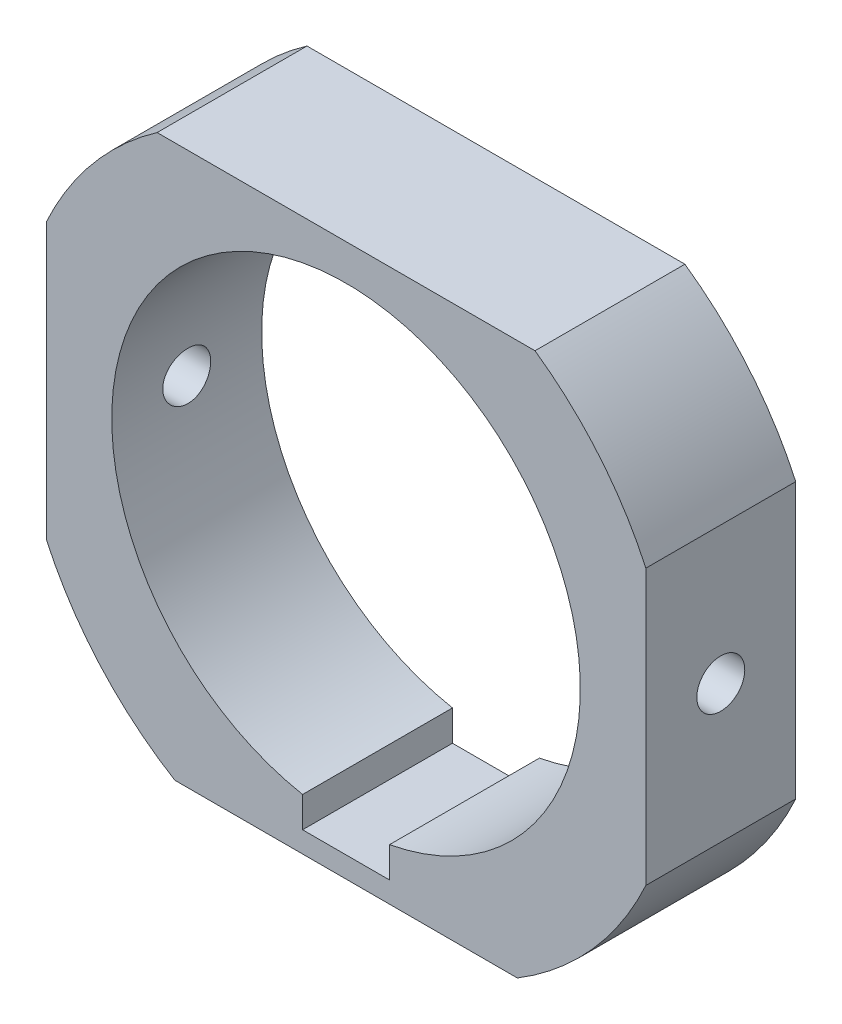
from build123d import *

# Parameters (mm, degrees)
BOSS_EXTRUDE1_DEPTH     = 5
CUT_EXTRUDE1_DEPTH      = 15.933519344
CUT_EXTRUDE1_DEPTH_BACK = 15.933519344
SKETCH2_W               = 5
SKETCH2_H               = 0.5
SKETCH3_R               = 0.8
CUT_EXTRUDE2_DEPTH      = 23.657449106


with BuildPart() as part:
    # Sketch1 → Boss-Extrude1 (new body)
    with BuildSketch(Plane.XY):
        with BuildLine():
            Line((6.303155956, 9.015), (-6.303155956, 9.015))
            ThreePointArc((-6.303155956, 9.015), (-8.447474169, 7.045578767), (-10, 4.582575695))
            Line((-10, 4.582575695), (-10, -4.582575695))
            ThreePointArc((-10, -4.582575695), (-7.860673921, -7.694790803), (-4.794788838, -9.9))
            Line((-4.794788838, -9.9), (4.794788838, -9.9))
            ThreePointArc((4.794788838, -9.9), (7.860673921, -7.694790803), (10, -4.582575695))
            Line((10, -4.582575695), (10, 4.582575695))
            ThreePointArc((10, 4.582575695), (8.447474169, 7.045578767), (6.303155956, 9.015))
        make_face()
        with BuildLine():
            Line((-1.45, -8.7), (-1.45, -7.679304982))
            ThreePointArc((-1.45, -7.679304982), (-4.987107127, 6.016891847), (7.815, 0))
            ThreePointArc((7.815, 0), (6.016891847, -4.987107127), (1.45, -7.679304982))
            Line((1.45, -7.679304982), (1.45, -8.7))
            Line((1.45, -8.7), (-1.45, -8.7))
        make_face(mode=Mode.SUBTRACT)
    extrude(amount=BOSS_EXTRUDE1_DEPTH)

    # Sketch2 → Cut-Extrude1 (cut, two sides: drawn at the far end of the back side and taken through both)
    with BuildSketch(Plane(origin=(0, 0, 0), x_dir=(0, 0, -1), z_dir=(1, 0, 0)).offset(-CUT_EXTRUDE1_DEPTH_BACK)):
        with Locations((-2.5, -9.65)):
            Rectangle(SKETCH2_W, SKETCH2_H)
    extrude(amount=CUT_EXTRUDE1_DEPTH + CUT_EXTRUDE1_DEPTH_BACK, mode=Mode.SUBTRACT)

    # Sketch3 → Cut-Extrude2 (cut, through all)
    with BuildSketch(Plane(origin=(10, 0, 0), x_dir=(0, 0, -1), z_dir=(1, 0, 0))):
        with Locations(Location((-2.5, 0, 0), (0, 0, 90))):
            Circle(SKETCH3_R)
    extrude(amount=-CUT_EXTRUDE2_DEPTH, mode=Mode.SUBTRACT)


solid = part.part
